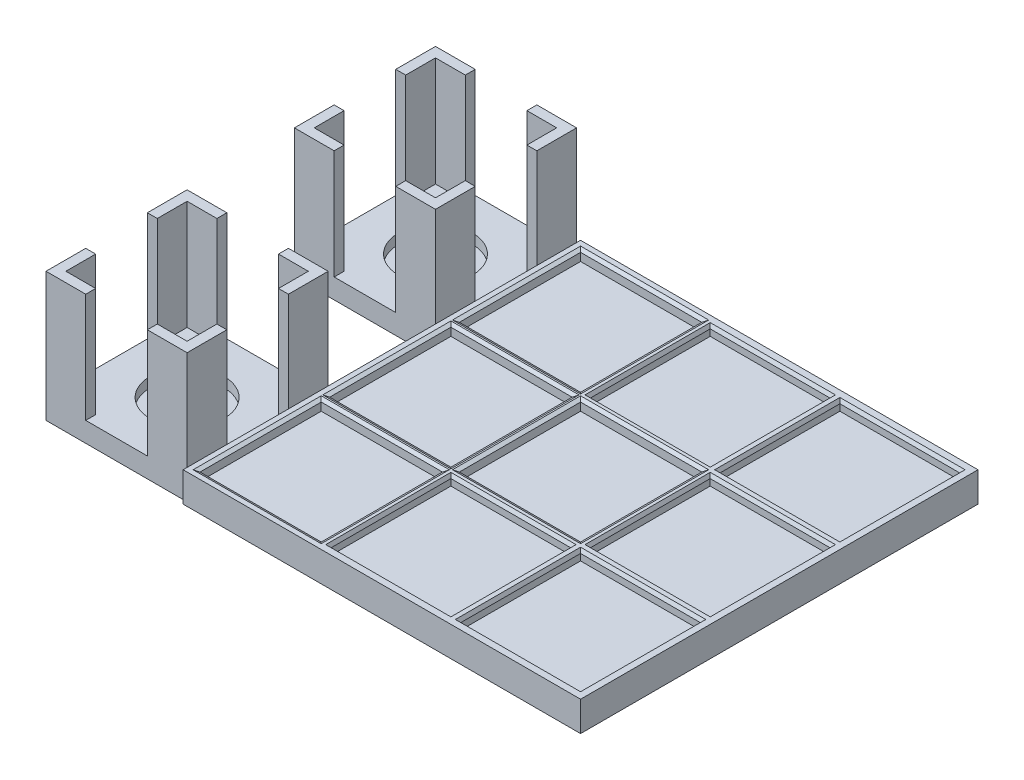
from build123d import *
from OCP.BRepFilletAPI import BRepFilletAPI_MakeChamfer

# Parameters (mm, degrees)
BOARDBASE_DEPTH     = 10
SKETCH1_6_W         = 200
SKETCH1_6_H         = 200
SKETCH1_6_W_2       = 61
SKETCH1_6_H_2       = 61
PIECEHOLDERS_DEPTH  = 15
PIECESLIDEAID_SIZE  = 1
PIECESLIDEAID_SIZE2 = 1.732050808
BOSS_EXTRUDE3_DEPTH = 65
SKETCH4_R           = 18.5
CUT_EXTRUDE1_DEPTH  = 5


with BuildPart() as part:
    # Sketch1 → BoardBase (new body)
    with BuildSketch(Plane(origin=(0, 0, 0), x_dir=(1, 0, 0), z_dir=(0, 1, 0))):
        Polygon((0, 2), (0, 0), (200, 0), (200, 200), (0, 200), (0, 198), (-71, 198), (-71, 127), (0, 127), (0, 73), (-71, 73), (-71, 2), align=None)
    extrude(amount=BOARDBASE_DEPTH)

    # Sketch1<6> → PieceHolders (add)
    with BuildSketch(Plane(origin=(0, 0, 0), x_dir=(1, 0, 0), z_dir=(0, 1, 0))):
        with Locations((100, 100)):
            Rectangle(SKETCH1_6_W, SKETCH1_6_H)
        with Locations((34.75, 165.25)):
            Rectangle(SKETCH1_6_W_2, SKETCH1_6_H_2, mode=Mode.SUBTRACT)
        with Locations((100, 165.25)):
            Rectangle(SKETCH1_6_W_2, SKETCH1_6_H_2, mode=Mode.SUBTRACT)
        with Locations((165.25, 165.25)):
            Rectangle(SKETCH1_6_W_2, SKETCH1_6_H_2, mode=Mode.SUBTRACT)
        with Locations((34.75, 100)):
            Rectangle(SKETCH1_6_W_2, SKETCH1_6_H_2, mode=Mode.SUBTRACT)
        with Locations((100, 100)):
            Rectangle(SKETCH1_6_W_2, SKETCH1_6_H_2, mode=Mode.SUBTRACT)
        with Locations((165.25, 100)):
            Rectangle(SKETCH1_6_W_2, SKETCH1_6_H_2, mode=Mode.SUBTRACT)
        with Locations((34.75, 34.75)):
            Rectangle(SKETCH1_6_W_2, SKETCH1_6_H_2, mode=Mode.SUBTRACT)
        with Locations((100, 34.75)):
            Rectangle(SKETCH1_6_W_2, SKETCH1_6_H_2, mode=Mode.SUBTRACT)
        with Locations((165.25, 34.75)):
            Rectangle(SKETCH1_6_W_2, SKETCH1_6_H_2, mode=Mode.SUBTRACT)
    extrude(amount=PIECEHOLDERS_DEPTH)

    # PieceSlideAid: one chamfer whose edges measure the first distance from different faces: ONE call of the kernel's chamfer builder (chamfer() names one face for all edges)
    pieceslideaid_edges_1 = [part.edges().sort_by_distance(p)[0] for p in [
        (165.25, 15, -4.25),
        (100, 15, -4.25),
        (165.25, 15, -69.5),
        (165.25, 15, -134.75),
        (100, 15, -134.75),
        (69.5, 15, -34.75),
        (134.75, 15, -100),
        (134.75, 15, -165.25),
        (69.5, 15, -165.25),
        (134.75, 15, -34.75),
        (100, 15, -195.75),
        (130.5, 15, -165.25),
        (165.25, 15, -195.75),
        (195.75, 15, -165.25),
        (165.25, 15, -130.5),
        (195.75, 15, -100),
        (100, 15, -65.25),
        (130.5, 15, -34.75),
        (165.25, 15, -65.25),
        (195.75, 15, -34.75),
    ]]
    pieceslideaid_side_1 = [part.faces().sort_by_distance(p)[0] for p in [
        (100, 15, -2.828427125),
    ]]
    pieceslideaid_edges_2 = [part.edges().sort_by_distance(p)[0] for p in [
        (34.75, 15, -4.25),
    ]]
    pieceslideaid_side_2 = [part.faces().sort_by_distance(p)[0] for p in [
        (34.75, 12.5, -4.25),
    ]]
    pieceslideaid_edges_3 = [part.edges().sort_by_distance(p)[0] for p in [
        (100, 15, -69.5),
    ]]
    pieceslideaid_side_3 = [part.faces().sort_by_distance(p)[0] for p in [
        (100, 12.5, -69.5),
    ]]
    pieceslideaid_edges_4 = [part.edges().sort_by_distance(p)[0] for p in [
        (34.75, 15, -69.5),
    ]]
    pieceslideaid_side_4 = [part.faces().sort_by_distance(p)[0] for p in [
        (34.75, 12.5, -69.5),
    ]]
    pieceslideaid_edges_5 = [part.edges().sort_by_distance(p)[0] for p in [
        (34.75, 15, -134.75),
    ]]
    pieceslideaid_side_5 = [part.faces().sort_by_distance(p)[0] for p in [
        (34.75, 12.5, -134.75),
    ]]
    pieceslideaid_edges_6 = [part.edges().sort_by_distance(p)[0] for p in [
        (4.25, 15, -34.75),
    ]]
    pieceslideaid_side_6 = [part.faces().sort_by_distance(p)[0] for p in [
        (4.25, 12.5, -34.75),
    ]]
    pieceslideaid_edges_7 = [part.edges().sort_by_distance(p)[0] for p in [
        (69.5, 15, -100),
    ]]
    pieceslideaid_side_7 = [part.faces().sort_by_distance(p)[0] for p in [
        (69.5, 12.5, -100),
    ]]
    pieceslideaid_edges_8 = [part.edges().sort_by_distance(p)[0] for p in [
        (4.25, 15, -100),
    ]]
    pieceslideaid_side_8 = [part.faces().sort_by_distance(p)[0] for p in [
        (4.25, 12.5, -100),
    ]]
    pieceslideaid_edges_9 = [part.edges().sort_by_distance(p)[0] for p in [
        (4.25, 15, -165.25),
    ]]
    pieceslideaid_side_9 = [part.faces().sort_by_distance(p)[0] for p in [
        (4.25, 12.5, -165.25),
    ]]
    pieceslideaid_edges_10 = [part.edges().sort_by_distance(p)[0] for p in [
        (34.75, 15, -195.75),
    ]]
    pieceslideaid_side_10 = [part.faces().sort_by_distance(p)[0] for p in [
        (34.75, 12.5, -195.75),
    ]]
    pieceslideaid_edges_11 = [part.edges().sort_by_distance(p)[0] for p in [
        (65.25, 15, -165.25),
    ]]
    pieceslideaid_side_11 = [part.faces().sort_by_distance(p)[0] for p in [
        (65.25, 12.5, -165.25),
    ]]
    pieceslideaid_edges_12 = [part.edges().sort_by_distance(p)[0] for p in [
        (34.75, 15, -130.5),
    ]]
    pieceslideaid_side_12 = [part.faces().sort_by_distance(p)[0] for p in [
        (34.75, 12.5, -130.5),
    ]]
    pieceslideaid_edges_13 = [part.edges().sort_by_distance(p)[0] for p in [
        (65.25, 15, -100),
    ]]
    pieceslideaid_side_13 = [part.faces().sort_by_distance(p)[0] for p in [
        (65.25, 12.5, -100),
    ]]
    pieceslideaid_edges_14 = [part.edges().sort_by_distance(p)[0] for p in [
        (100, 15, -130.5),
    ]]
    pieceslideaid_side_14 = [part.faces().sort_by_distance(p)[0] for p in [
        (100, 12.5, -130.5),
    ]]
    pieceslideaid_edges_15 = [part.edges().sort_by_distance(p)[0] for p in [
        (130.5, 15, -100),
    ]]
    pieceslideaid_side_15 = [part.faces().sort_by_distance(p)[0] for p in [
        (130.5, 12.5, -100),
    ]]
    pieceslideaid_edges_16 = [part.edges().sort_by_distance(p)[0] for p in [
        (34.75, 15, -65.25),
    ]]
    pieceslideaid_side_16 = [part.faces().sort_by_distance(p)[0] for p in [
        (34.75, 12.5, -65.25),
    ]]
    pieceslideaid_edges_17 = [part.edges().sort_by_distance(p)[0] for p in [
        (65.25, 15, -34.75),
    ]]
    pieceslideaid_side_17 = [part.faces().sort_by_distance(p)[0] for p in [
        (65.25, 12.5, -34.75),
    ]]
    pieceslideaid = BRepFilletAPI_MakeChamfer(part.part.solid().wrapped)
    for e in pieceslideaid_edges_1:
        pieceslideaid.Add(PIECESLIDEAID_SIZE, PIECESLIDEAID_SIZE2, e.wrapped, pieceslideaid_side_1[0].wrapped)  # the first distance lies on this face
    for e in pieceslideaid_edges_2:
        pieceslideaid.Add(PIECESLIDEAID_SIZE, PIECESLIDEAID_SIZE2, e.wrapped, pieceslideaid_side_2[0].wrapped)  # the first distance lies on this face
    for e in pieceslideaid_edges_3:
        pieceslideaid.Add(PIECESLIDEAID_SIZE, PIECESLIDEAID_SIZE2, e.wrapped, pieceslideaid_side_3[0].wrapped)  # the first distance lies on this face
    for e in pieceslideaid_edges_4:
        pieceslideaid.Add(PIECESLIDEAID_SIZE, PIECESLIDEAID_SIZE2, e.wrapped, pieceslideaid_side_4[0].wrapped)  # the first distance lies on this face
    for e in pieceslideaid_edges_5:
        pieceslideaid.Add(PIECESLIDEAID_SIZE, PIECESLIDEAID_SIZE2, e.wrapped, pieceslideaid_side_5[0].wrapped)  # the first distance lies on this face
    for e in pieceslideaid_edges_6:
        pieceslideaid.Add(PIECESLIDEAID_SIZE, PIECESLIDEAID_SIZE2, e.wrapped, pieceslideaid_side_6[0].wrapped)  # the first distance lies on this face
    for e in pieceslideaid_edges_7:
        pieceslideaid.Add(PIECESLIDEAID_SIZE, PIECESLIDEAID_SIZE2, e.wrapped, pieceslideaid_side_7[0].wrapped)  # the first distance lies on this face
    for e in pieceslideaid_edges_8:
        pieceslideaid.Add(PIECESLIDEAID_SIZE, PIECESLIDEAID_SIZE2, e.wrapped, pieceslideaid_side_8[0].wrapped)  # the first distance lies on this face
    for e in pieceslideaid_edges_9:
        pieceslideaid.Add(PIECESLIDEAID_SIZE, PIECESLIDEAID_SIZE2, e.wrapped, pieceslideaid_side_9[0].wrapped)  # the first distance lies on this face
    for e in pieceslideaid_edges_10:
        pieceslideaid.Add(PIECESLIDEAID_SIZE, PIECESLIDEAID_SIZE2, e.wrapped, pieceslideaid_side_10[0].wrapped)  # the first distance lies on this face
    for e in pieceslideaid_edges_11:
        pieceslideaid.Add(PIECESLIDEAID_SIZE, PIECESLIDEAID_SIZE2, e.wrapped, pieceslideaid_side_11[0].wrapped)  # the first distance lies on this face
    for e in pieceslideaid_edges_12:
        pieceslideaid.Add(PIECESLIDEAID_SIZE, PIECESLIDEAID_SIZE2, e.wrapped, pieceslideaid_side_12[0].wrapped)  # the first distance lies on this face
    for e in pieceslideaid_edges_13:
        pieceslideaid.Add(PIECESLIDEAID_SIZE, PIECESLIDEAID_SIZE2, e.wrapped, pieceslideaid_side_13[0].wrapped)  # the first distance lies on this face
    for e in pieceslideaid_edges_14:
        pieceslideaid.Add(PIECESLIDEAID_SIZE, PIECESLIDEAID_SIZE2, e.wrapped, pieceslideaid_side_14[0].wrapped)  # the first distance lies on this face
    for e in pieceslideaid_edges_15:
        pieceslideaid.Add(PIECESLIDEAID_SIZE, PIECESLIDEAID_SIZE2, e.wrapped, pieceslideaid_side_15[0].wrapped)  # the first distance lies on this face
    for e in pieceslideaid_edges_16:
        pieceslideaid.Add(PIECESLIDEAID_SIZE, PIECESLIDEAID_SIZE2, e.wrapped, pieceslideaid_side_16[0].wrapped)  # the first distance lies on this face
    for e in pieceslideaid_edges_17:
        pieceslideaid.Add(PIECESLIDEAID_SIZE, PIECESLIDEAID_SIZE2, e.wrapped, pieceslideaid_side_17[0].wrapped)  # the first distance lies on this face
    add(Compound.cast(pieceslideaid.Shape()), mode=Mode.REPLACE)

    # Sketch1<8> → Boss-Extrude3 (add)
    with BuildSketch(Plane(origin=(0, 0, 0), x_dir=(1, 0, 0), z_dir=(0, 1, 0))):
        Polygon((-71, 127), (-51, 127), (-51, 132), (-66, 132), (-66, 147), (-71, 147), align=None)
        Polygon((-51, 193), (-51, 198), (-71, 198), (-71, 178), (-66, 178), (-66, 193), align=None)
        Polygon((0, 178), (0, 198), (-20, 198), (-20, 193), (-5, 193), (-5, 178), align=None)
        Polygon((-20, 127), (0, 127), (0, 147), (-5, 147), (-5, 132), (-20, 132), align=None)
        Polygon((-51, 68), (-51, 73), (-71, 73), (-71, 53), (-66, 53), (-66, 68), align=None)
        Polygon((-71, 2), (-51, 2), (-51, 7), (-66, 7), (-66, 22), (-71, 22), align=None)
        Polygon((-20, 2), (0, 2), (0, 22), (-5, 22), (-5, 7), (-20, 7), align=None)
        Polygon((-5, 53), (0, 53), (0, 73), (-20, 73), (-20, 68), (-5, 68), align=None)
    extrude(amount=BOSS_EXTRUDE3_DEPTH)

    # Sketch4 → Cut-Extrude1 (cut)
    with BuildSketch(Plane(origin=(0, 10, 0), x_dir=(1, 0, 0), z_dir=(0, 1, 0))):
        with Locations(Location((-35.5, 37.5, 0), (0, 0, 270))):
            Circle(SKETCH4_R)
        with Locations(Location((-35.5, 162.5, 0), (0, 0, 270))):
            Circle(SKETCH4_R)
    extrude(amount=-CUT_EXTRUDE1_DEPTH, mode=Mode.SUBTRACT)


solid = part.part
